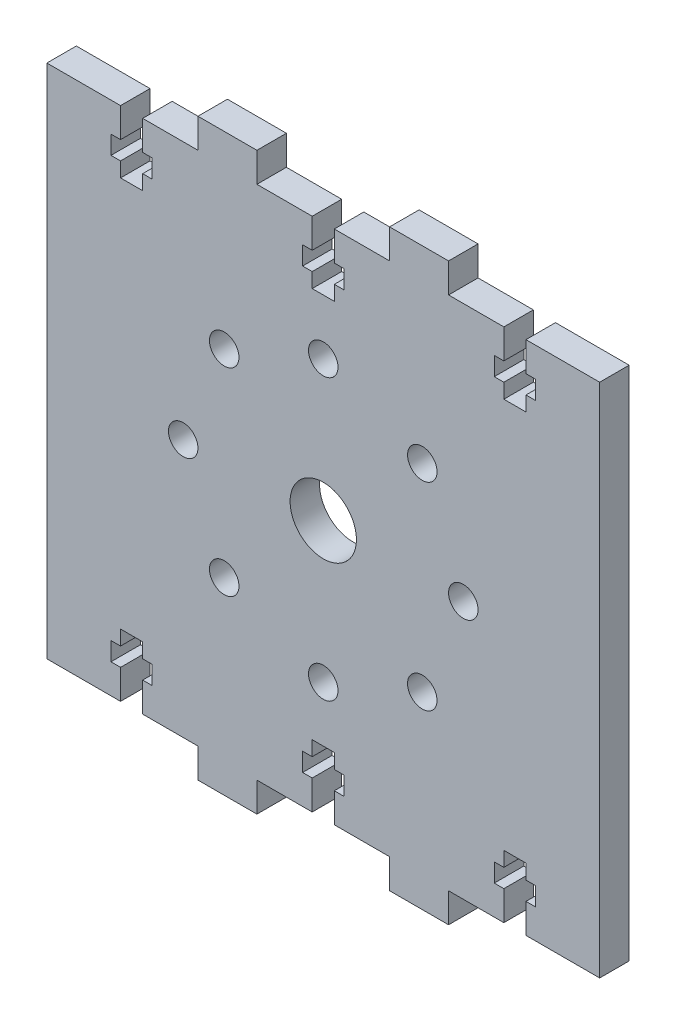
from build123d import *

# Parameters (mm, degrees)
SKETCH_1_W          = 75
SKETCH_1_H          = 70
SKETCH_1_R          = 4.5
SKETCH_1_R_2        = 2
EXTRUDE_1_DEPTH     = 4
CUT_EXTRUDE_1_DEPTH = 4
SKETCH_3_W          = 8
SKETCH_3_H          = 4
EXTRUDE_2_DEPTH     = 4


with BuildPart() as part:
    # 草图1 → 凸台-拉伸1 (new body)
    with BuildSketch(Plane.XY):
        Rectangle(SKETCH_1_W, SKETCH_1_H)
        Circle(SKETCH_1_R, mode=Mode.SUBTRACT)
        with Locations((19, 0)):
            Circle(SKETCH_1_R_2, mode=Mode.SUBTRACT)
        with Locations((13.435028843, -13.435028843)):
            Circle(SKETCH_1_R_2, mode=Mode.SUBTRACT)
        with Locations((0, -19)):
            Circle(SKETCH_1_R_2, mode=Mode.SUBTRACT)
        with Locations((-13.435028843, -13.435028843)):
            Circle(SKETCH_1_R_2, mode=Mode.SUBTRACT)
        with Locations((-19, 0)):
            Circle(SKETCH_1_R_2, mode=Mode.SUBTRACT)
        with Locations((-13.435028843, 13.435028843)):
            Circle(SKETCH_1_R_2, mode=Mode.SUBTRACT)
        with Locations((0, 19)):
            Circle(SKETCH_1_R_2, mode=Mode.SUBTRACT)
        with Locations((13.435028843, 13.435028843)):
            Circle(SKETCH_1_R_2, mode=Mode.SUBTRACT)
    extrude(amount=EXTRUDE_1_DEPTH)

    # 草图2 → 切除-拉伸1 (cut)
    with BuildSketch(Plane.XY.offset(4)):
        Polygon((-1.5, 35), (1.5, 35), (1.5, 31), (2.8, 31), (2.8, 28.5), (1.5, 28.5), (1.5, 26.5), (-1.5, 26.5), (-1.5, 28.5), (-2.8, 28.5), (-2.8, 31), (-1.5, 31), align=None)
        Polygon((27.5, 35), (27.5, 31), (28.8, 31), (28.8, 28.5), (27.5, 28.5), (27.5, 26.5), (24.5, 26.5), (24.5, 28.5), (23.2, 28.5), (23.2, 31), (24.5, 31), (24.5, 35), align=None)
        Polygon((-27.5, 35), (-24.5, 35), (-24.5, 31), (-23.2, 31), (-23.2, 28.5), (-24.5, 28.5), (-24.5, 26.5), (-27.5, 26.5), (-27.5, 28.5), (-28.8, 28.5), (-28.8, 31), (-27.5, 31), align=None)
        Polygon((-27.5, -35), (-27.5, -31), (-28.8, -31), (-28.8, -28.5), (-27.5, -28.5), (-27.5, -26.5), (-24.5, -26.5), (-24.5, -28.5), (-23.2, -28.5), (-23.2, -31), (-24.5, -31), (-24.5, -35), align=None)
        Polygon((27.5, -35), (24.5, -35), (24.5, -31), (23.2, -31), (23.2, -28.5), (24.5, -28.5), (24.5, -26.5), (27.5, -26.5), (27.5, -28.5), (28.8, -28.5), (28.8, -31), (27.5, -31), align=None)
        Polygon((-1.5, -35), (-1.5, -31), (-2.8, -31), (-2.8, -28.5), (-1.5, -28.5), (-1.5, -26.5), (1.5, -26.5), (1.5, -28.5), (2.8, -28.5), (2.8, -31), (1.5, -31), (1.5, -35), align=None)
    extrude(amount=-CUT_EXTRUDE_1_DEPTH, mode=Mode.SUBTRACT)

    # 草图3 → 凸台-拉伸2 (add)
    with BuildSketch(Plane.XY.offset(4)):
        with Locations((-13, -37)):
            Rectangle(SKETCH_3_W, SKETCH_3_H)
        with Locations((13, -37)):
            Rectangle(SKETCH_3_W, SKETCH_3_H)
        with Locations((13, 37)):
            Rectangle(SKETCH_3_W, SKETCH_3_H)
        with Locations((-13, 37)):
            Rectangle(SKETCH_3_W, SKETCH_3_H)
    extrude(amount=-EXTRUDE_2_DEPTH)


solid = part.part
